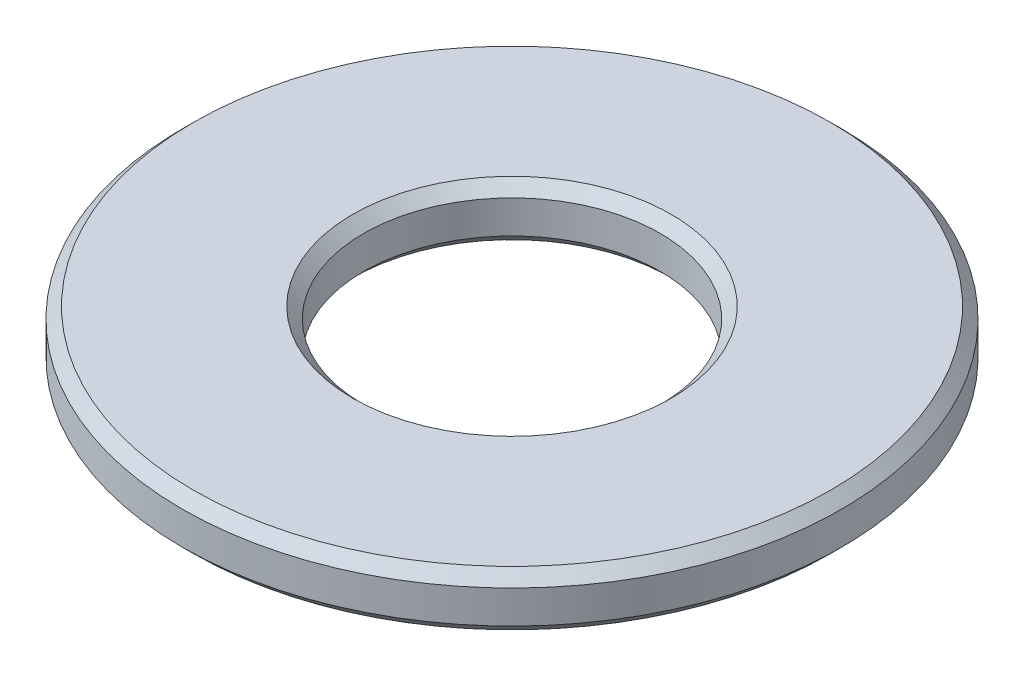
from build123d import *

# Parameters (mm, degrees)
SKETCH1_R           = 3
SKETCH1_R_2         = 1.35
BOSS_EXTRUDE1_DEPTH = 0.5
CHAMFER1_SIZE       = 0.1


with BuildPart() as part:
    # Sketch1 → Boss-Extrude1 (new body)
    with BuildSketch(Plane(origin=(0, 0, 0), x_dir=(1, 0, 0), z_dir=(0, 1, 0))):
        with Locations(Location((0, 0, 0), (0, 0, 270))):
            Circle(SKETCH1_R)
        with Locations(Location((0, 0, 0), (0, 0, 270))):
            Circle(SKETCH1_R_2, mode=Mode.SUBTRACT)
    extrude(amount=BOSS_EXTRUDE1_DEPTH)

    # Chamfer1
    chamfer1_edges = [part.edges().sort_by_distance(p)[0] for p in [
        (0, 0, -3),
        (0, 0.5, -3),
        (0, 0, -1.35),
        (0, 0.5, -1.35),
    ]]
    chamfer(chamfer1_edges, length=CHAMFER1_SIZE)


solid = part.part
